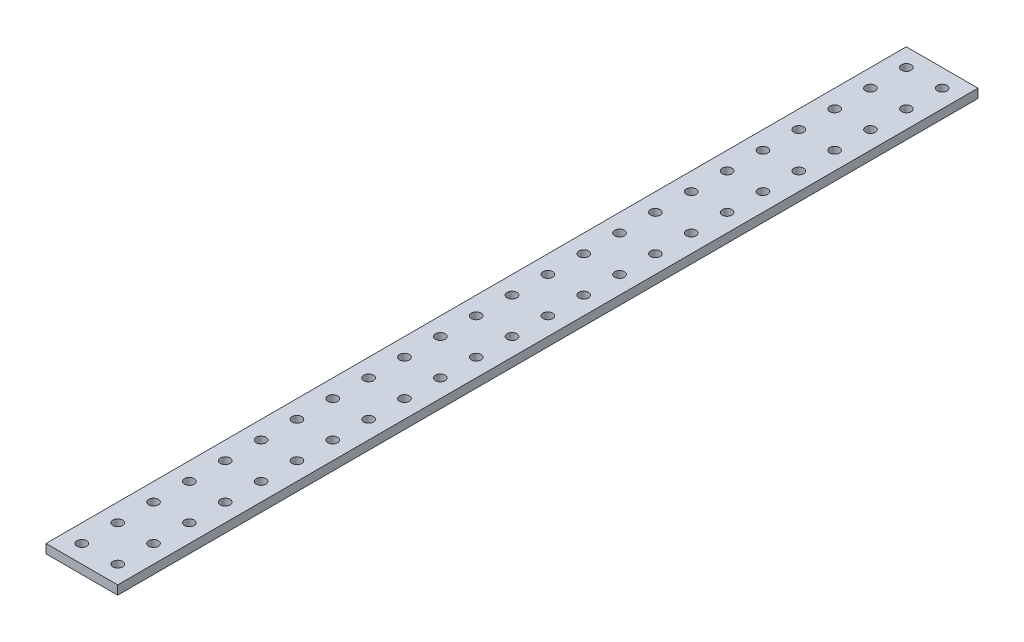
from build123d import *

# Parameters (mm, degrees)
SKETCH1_W           = 50.8
SKETCH1_H           = 609.6
SKETCH1_R           = 3.429
BOSS_EXTRUDE1_DEPTH = 6.35


with BuildPart() as part:
    # Sketch1 → Boss-Extrude1 (new body)
    with BuildSketch(Plane(origin=(0, 0, 0), x_dir=(1, 0, 0), z_dir=(0, 1, 0))):
        Rectangle(SKETCH1_W, SKETCH1_H)
        with Locations(Location((-12.7, 292.1, 0), (0, 0, 270))):
            Circle(SKETCH1_R, mode=Mode.SUBTRACT)
        with Locations(Location((12.7, 292.1, 0), (0, 0, 270))):
            Circle(SKETCH1_R, mode=Mode.SUBTRACT)
        with Locations(Location((12.7, 266.7, 0), (0, 0, 270))):
            Circle(SKETCH1_R, mode=Mode.SUBTRACT)
        with Locations(Location((12.7, 241.3, 0), (0, 0, 270))):
            Circle(SKETCH1_R, mode=Mode.SUBTRACT)
        with Locations(Location((12.7, 215.9, 0), (0, 0, 270))):
            Circle(SKETCH1_R, mode=Mode.SUBTRACT)
        with Locations(Location((12.7, 190.5, 0), (0, 0, 270))):
            Circle(SKETCH1_R, mode=Mode.SUBTRACT)
        with Locations(Location((12.7, 165.1, 0), (0, 0, 270))):
            Circle(SKETCH1_R, mode=Mode.SUBTRACT)
        with Locations(Location((12.7, 139.7, 0), (0, 0, 270))):
            Circle(SKETCH1_R, mode=Mode.SUBTRACT)
        with Locations(Location((12.7, 114.3, 0), (0, 0, 270))):
            Circle(SKETCH1_R, mode=Mode.SUBTRACT)
        with Locations(Location((12.7, 88.9, 0), (0, 0, 270))):
            Circle(SKETCH1_R, mode=Mode.SUBTRACT)
        with Locations(Location((12.7, 63.5, 0), (0, 0, 270))):
            Circle(SKETCH1_R, mode=Mode.SUBTRACT)
        with Locations(Location((12.7, 38.1, 0), (0, 0, 270))):
            Circle(SKETCH1_R, mode=Mode.SUBTRACT)
        with Locations(Location((12.7, 12.7, 0), (0, 0, 270))):
            Circle(SKETCH1_R, mode=Mode.SUBTRACT)
        with Locations(Location((12.7, -12.7, 0), (0, 0, 270))):
            Circle(SKETCH1_R, mode=Mode.SUBTRACT)
        with Locations(Location((12.7, -38.1, 0), (0, 0, 270))):
            Circle(SKETCH1_R, mode=Mode.SUBTRACT)
        with Locations(Location((12.7, -63.5, 0), (0, 0, 270))):
            Circle(SKETCH1_R, mode=Mode.SUBTRACT)
        with Locations(Location((12.7, -88.9, 0), (0, 0, 270))):
            Circle(SKETCH1_R, mode=Mode.SUBTRACT)
        with Locations(Location((12.7, -114.3, 0), (0, 0, 270))):
            Circle(SKETCH1_R, mode=Mode.SUBTRACT)
        with Locations(Location((12.7, -139.7, 0), (0, 0, 270))):
            Circle(SKETCH1_R, mode=Mode.SUBTRACT)
        with Locations(Location((12.7, -165.1, 0), (0, 0, 270))):
            Circle(SKETCH1_R, mode=Mode.SUBTRACT)
        with Locations(Location((12.7, -190.5, 0), (0, 0, 270))):
            Circle(SKETCH1_R, mode=Mode.SUBTRACT)
        with Locations(Location((12.7, -215.9, 0), (0, 0, 270))):
            Circle(SKETCH1_R, mode=Mode.SUBTRACT)
        with Locations(Location((12.7, -241.3, 0), (0, 0, 270))):
            Circle(SKETCH1_R, mode=Mode.SUBTRACT)
        with Locations(Location((12.7, -266.7, 0), (0, 0, 270))):
            Circle(SKETCH1_R, mode=Mode.SUBTRACT)
        with Locations(Location((12.7, -292.1, 0), (0, 0, 270))):
            Circle(SKETCH1_R, mode=Mode.SUBTRACT)
        with Locations(Location((-12.7, 266.7, 0), (0, 0, 270))):
            Circle(SKETCH1_R, mode=Mode.SUBTRACT)
        with Locations(Location((-12.7, 241.3, 0), (0, 0, 270))):
            Circle(SKETCH1_R, mode=Mode.SUBTRACT)
        with Locations(Location((-12.7, 215.9, 0), (0, 0, 270))):
            Circle(SKETCH1_R, mode=Mode.SUBTRACT)
        with Locations(Location((-12.7, 190.5, 0), (0, 0, 270))):
            Circle(SKETCH1_R, mode=Mode.SUBTRACT)
        with Locations(Location((-12.7, 165.1, 0), (0, 0, 270))):
            Circle(SKETCH1_R, mode=Mode.SUBTRACT)
        with Locations(Location((-12.7, 139.7, 0), (0, 0, 270))):
            Circle(SKETCH1_R, mode=Mode.SUBTRACT)
        with Locations(Location((-12.7, 114.3, 0), (0, 0, 270))):
            Circle(SKETCH1_R, mode=Mode.SUBTRACT)
        with Locations(Location((-12.7, 88.9, 0), (0, 0, 270))):
            Circle(SKETCH1_R, mode=Mode.SUBTRACT)
        with Locations(Location((-12.7, 63.5, 0), (0, 0, 270))):
            Circle(SKETCH1_R, mode=Mode.SUBTRACT)
        with Locations(Location((-12.7, 38.1, 0), (0, 0, 270))):
            Circle(SKETCH1_R, mode=Mode.SUBTRACT)
        with Locations(Location((-12.7, 12.7, 0), (0, 0, 270))):
            Circle(SKETCH1_R, mode=Mode.SUBTRACT)
        with Locations(Location((-12.7, -12.7, 0), (0, 0, 270))):
            Circle(SKETCH1_R, mode=Mode.SUBTRACT)
        with Locations(Location((-12.7, -38.1, 0), (0, 0, 270))):
            Circle(SKETCH1_R, mode=Mode.SUBTRACT)
        with Locations(Location((-12.7, -63.5, 0), (0, 0, 270))):
            Circle(SKETCH1_R, mode=Mode.SUBTRACT)
        with Locations(Location((-12.7, -88.9, 0), (0, 0, 270))):
            Circle(SKETCH1_R, mode=Mode.SUBTRACT)
        with Locations(Location((-12.7, -114.3, 0), (0, 0, 270))):
            Circle(SKETCH1_R, mode=Mode.SUBTRACT)
        with Locations(Location((-12.7, -139.7, 0), (0, 0, 270))):
            Circle(SKETCH1_R, mode=Mode.SUBTRACT)
        with Locations(Location((-12.7, -165.1, 0), (0, 0, 270))):
            Circle(SKETCH1_R, mode=Mode.SUBTRACT)
        with Locations(Location((-12.7, -190.5, 0), (0, 0, 270))):
            Circle(SKETCH1_R, mode=Mode.SUBTRACT)
        with Locations(Location((-12.7, -215.9, 0), (0, 0, 270))):
            Circle(SKETCH1_R, mode=Mode.SUBTRACT)
        with Locations(Location((-12.7, -241.3, 0), (0, 0, 270))):
            Circle(SKETCH1_R, mode=Mode.SUBTRACT)
        with Locations(Location((-12.7, -266.7, 0), (0, 0, 270))):
            Circle(SKETCH1_R, mode=Mode.SUBTRACT)
        with Locations(Location((-12.7, -292.1, 0), (0, 0, 270))):
            Circle(SKETCH1_R, mode=Mode.SUBTRACT)
    extrude(amount=BOSS_EXTRUDE1_DEPTH)


solid = part.part
